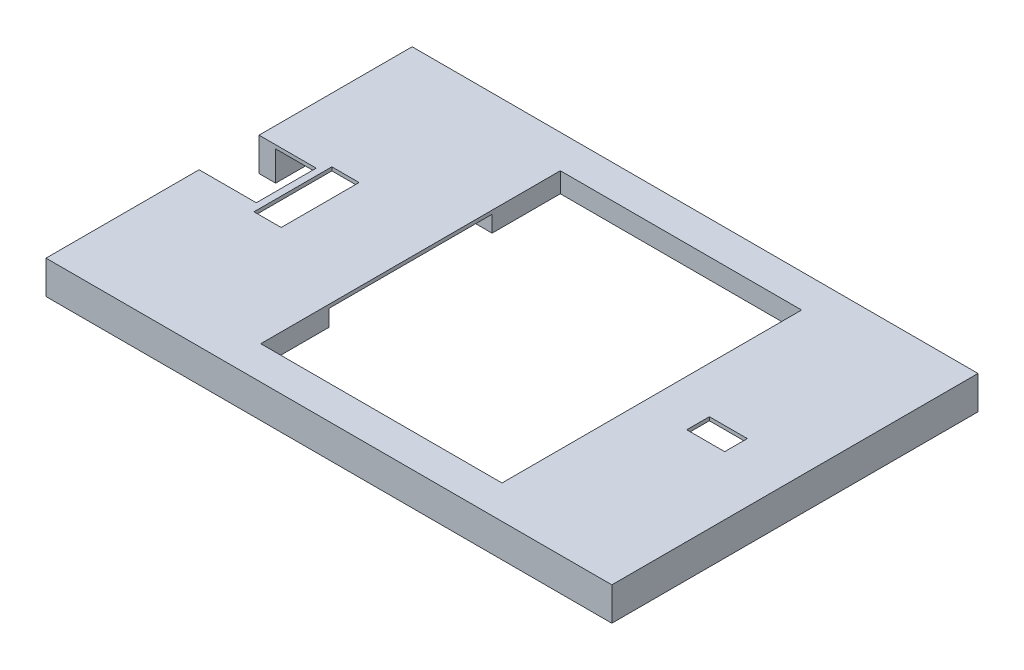
from build123d import *

# Parameters (mm, degrees)
SKETCH1_W               = 5.7
SKETCH1_H               = 3.4
SKETCH1_W_2             = 36.24
SKETCH1_H_2             = 45
BOSS_EXTRUDE1_DEPTH     = 3
CUT_EXTRUDE1_DEPTH      = 61
CUT_EXTRUDE1_DEPTH_BACK = 19
SKETCH3_W               = 24.5
SKETCH3_H               = 2.46523088
BOSS_EXTRUDE2_DEPTH     = 2


with BuildPart() as part:
    # Sketch1 → Boss-Extrude1 (new body)
    with BuildSketch(Plane(origin=(0, 0, 0), x_dir=(1, 0, 0), z_dir=(0, 1, 0))):
        Polygon((85, 0), (0, 0), (0, -23), (8.59, -23), (8.59, -32), (0, -32), (0, -55), (85, -55), align=None)
        Polygon((9.59, -33.35), (9.59, -32.35), (9.59, -22.65), (9.59, -21.65), (13.68, -21.65), (13.68, -33.35), align=None, mode=Mode.SUBTRACT)
        with Locations((73.3, -27.5)):
            Rectangle(SKETCH1_W, SKETCH1_H, mode=Mode.SUBTRACT)
        with Locations((45.38, -27.5)):
            Rectangle(SKETCH1_W_2, SKETCH1_H_2, mode=Mode.SUBTRACT)
    extrude(amount=BOSS_EXTRUDE1_DEPTH)

    # Sketch3 → Cut-Extrude1 (cut, two sides: drawn at the far end of the back side and taken through both)
    with BuildSketch(Plane.ZY.offset(-63.5).offset(-CUT_EXTRUDE1_DEPTH_BACK)):
        with Locations((27.5, 1.23261544)):
            Rectangle(SKETCH3_W, SKETCH3_H)
    extrude(amount=CUT_EXTRUDE1_DEPTH + CUT_EXTRUDE1_DEPTH_BACK, mode=Mode.SUBTRACT)

    # Sketch4 → Boss-Extrude2 (add)
    with BuildSketch(Plane.XZ):
        Polygon((0, 32), (2.5, 32), (2.5, 39.75), (2.5, 52.5), (82.5, 52.5), (82.5, 39.75), (82.5, 15.25), (82.5, 2.5), (2.5, 2.5), (2.5, 15.25), (2.5, 23), (0, 23), (0, 0), (85, 0), (85, 55), (0, 55), align=None)
    extrude(amount=BOSS_EXTRUDE2_DEPTH)


solid = part.part
